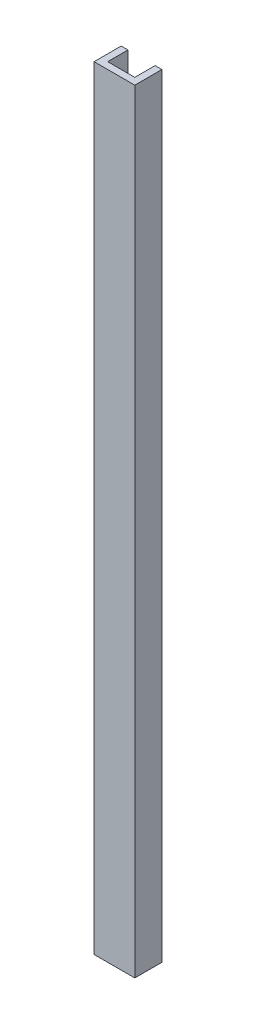
from build123d import *

# Parameters (mm, degrees)
EXTRUDE_THIN1_DEPTH = 361.95


with BuildPart() as part:
    # Sketch1 → Extrude-Thin1 (new body)
    with BuildSketch(Plane(origin=(0, 0, 0), x_dir=(1, 0, 0), z_dir=(0, 1, 0))):
        Polygon((0, 12.7), (0, 0), (19.05, 0), (19.05, 12.7), (15.875, 12.7), (15.875, 3.175), (3.175, 3.175), (3.175, 12.7), align=None)
    extrude(amount=EXTRUDE_THIN1_DEPTH)


solid = part.part
